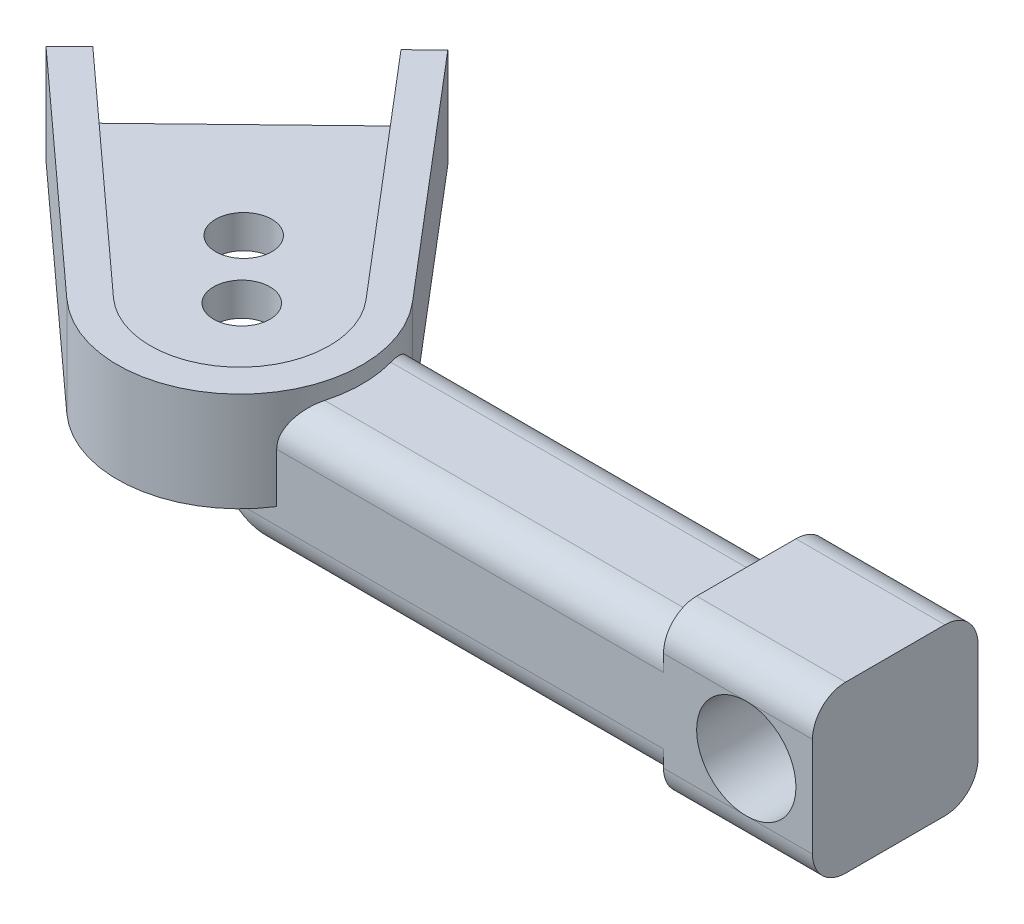
from build123d import *

# Parameters (mm, degrees)
SKETCH_1_W                = 20.5
SKETCH_1_H                = 4
EXTRUDE_1_DEPTH           = 2
SKETCH_2_R                = 0.85
CUT_EXTRUDE_1_DEPTH       = 13
SKETCH_3_R                = 0.8
CUT_EXTRUDE_2_DEPTH       = 3
FILLET_1_R                = 1
SKETCH_4_W                = 4
SKETCH_4_H                = 4
CUT_EXTRUDE_5_DEPTH       = 1.5
CUT_EXTRUDE_6_DEPTH       = 1.5
SKETCH_7_W                = 1
SKETCH_7_H                = 4
EXTRUDE_2_DEPTH           = 1
FILLET_2_R                = 1
EXTRUDE_3_DEPTH           = 3
CUT_EXTRUDE_7_DEPTH       = 3
EXTRUDE_4_DEPTH           = 1
SKETCH_10_R               = 0.85
CUT_EXTRUDE_8_DEPTH       = 1
EXTRUDE_5_REACH           = 23.907
CUT_EXTRUDE_9_DEPTH       = 20.215826188
EXTRUDE_6_DEPTH           = 5
CUT_EXTRUDE_10_DEPTH      = 22.907341564
CUT_EXTRUDE_10_DEPTH_BACK = 22.907341564
SKETCH_14_R               = 1.5
FILLET_3_R                = 1


with BuildPart() as part:
    # 草图1 → 凸台-拉伸1 (new, symmetric)
    with BuildSketch(Plane.XY):
        Rectangle(SKETCH_1_W, SKETCH_1_H)
    extrude(amount=EXTRUDE_1_DEPTH, both=True)

    # 草图2 → 切除-拉伸1 (cut)
    with BuildSketch(Plane.XZ.offset(2)):
        with Locations(Location((-9.048459148, 0, 0), (0, 0, 270))):
            Circle(SKETCH_2_R)
    extrude(amount=-CUT_EXTRUDE_1_DEPTH, mode=Mode.SUBTRACT)

    # 草图3 → 切除-拉伸2 (cut)
    with BuildSketch(Plane.XY.offset(2)):
        with Locations((8.25, 0)):
            Circle(SKETCH_3_R)
    extrude(amount=-CUT_EXTRUDE_2_DEPTH, mode=Mode.SUBTRACT)

    # 圆角1
    fillet_1_edges = [part.edges().sort_by_distance(p)[0] for p in [
        (0, -2, 2),
        (0, -2, -2),
        (0, 2, -2),
        (0, 2, 2),
    ]]
    fillet(fillet_1_edges, radius=FILLET_1_R)

    # 草图4 → 切除-拉伸5 (cut)
    with BuildSketch(Plane.XZ.offset(2)):
        with Locations((-8.25, 0)):
            Rectangle(SKETCH_4_W, SKETCH_4_H)
    extrude(amount=-CUT_EXTRUDE_5_DEPTH, mode=Mode.SUBTRACT)

    # 草图5 → 切除-拉伸6 (cut)
    with BuildSketch(Plane(origin=(0, 2, 0), x_dir=(1, 0, 0), z_dir=(0, 1, 0))):
        Polygon((-6.25, 0), (-6.25, 2), (-10.25, 2), (-10.25, -2), (-6.25, -2), align=None)
    extrude(amount=-CUT_EXTRUDE_6_DEPTH, mode=Mode.SUBTRACT)

    # 草图7 → 凸台-拉伸2 (add)
    with BuildSketch(Plane.XZ.offset(0.5)):
        with Locations((-10.75, 0)):
            Rectangle(SKETCH_7_W, SKETCH_7_H)
    extrude(amount=-EXTRUDE_2_DEPTH)

    # 圆角2
    fillet_2_edges = [part.edges().sort_by_distance(p)[0] for p in [
        (-11.25, 0, 2),
        (-11.25, 0, -2),
    ]]
    fillet(fillet_2_edges, radius=FILLET_2_R)

    # 草图8 → 凸台-拉伸3 (add)
    with BuildSketch(Plane.XZ.offset(0.5)):
        with BuildLine():
            Line((-13.011033862, -8.830832343), (-6.991216755, -1.748643399))
            ThreePointArc((-6.991216755, -1.748643399), (-7.171159983, 1.940553489), (-10.864293035, 1.998186001))
            Line((-10.864293035, 1.998186001), (-17.742872996, -4.252662808))
            Line((-17.742872996, -4.252662808), (-18.461553282, -3.557322138))
            Line((-18.461553282, -3.557322138), (-11.537428317, 2.737705696))
            ThreePointArc((-11.537428317, 2.737705696), (-6.475862877, 2.659275921), (-6.229806023, -2.396913549))
            Line((-6.229806023, -2.396913549), (-12.292353576, -9.526173013))
            Line((-12.292353576, -9.526173013), (-13.011033862, -8.830832343))
        make_face()
    extrude(amount=-EXTRUDE_3_DEPTH)

    # 草图9 → 切除-拉伸7 (cut)
    with BuildSketch(Plane.XZ.offset(0.5)):
        with BuildLine():
            Line((-13.011033862, -8.830832343), (-6.989420262, -1.751365983))
            ThreePointArc((-6.989420262, -1.751365983), (-7.168982159, 1.942804723), (-10.867073667, 1.999891291))
            Line((-10.867073667, 1.999891291), (-17.742872996, -4.252662808))
            Line((-17.742872996, -4.252662808), (-13.011033862, -8.830832343))
        make_face()
    extrude(amount=-CUT_EXTRUDE_7_DEPTH, mode=Mode.SUBTRACT)

    # 草图9<2> → 凸台-拉伸4 (add)
    with BuildSketch(Plane.XZ.offset(0.5)):
        with BuildLine():
            Line((-13.011033862, -8.830832343), (-6.989420262, -1.751365983))
            ThreePointArc((-6.989420262, -1.751365983), (-7.168982159, 1.942804723), (-10.867073667, 1.999891291))
            Line((-10.867073667, 1.999891291), (-17.742872996, -4.252662808))
            Line((-17.742872996, -4.252662808), (-13.011033862, -8.830832343))
        make_face()
    extrude(amount=-EXTRUDE_4_DEPTH)

    # 草图10 → 切除-拉伸8 (cut)
    with BuildSketch(Plane(origin=(0, 0.5, 0), x_dir=(1, 0, 0), z_dir=(0, 1, 0))):
        with Locations(Location((-10.786836392, 1.796675975, 0), (0, 0, 270))):
            Circle(SKETCH_10_R)
        with Locations(Location((-12.525213635, 3.59335195, 0), (0, 0, 270))):
            Circle(SKETCH_10_R)
    extrude(amount=-CUT_EXTRUDE_8_DEPTH, mode=Mode.SUBTRACT)

    # 凸台-拉伸5: up to this face of the body (flat: up to its plane)
    extrude_5_end = Plane(part.part.faces().sort_by_distance((2.117336662, -0.003624728, -2))[0])
    # 草图11 → 凸台-拉伸5 (add, up to the picked face)
    with BuildSketch(Plane.XY.offset(2), mode=Mode.PRIVATE) as extrude_5_sk1:
        Polygon((-6.25, -2), (-6.25, -0.5), (-7.75, -0.5), align=None)
    extrude_5_tool1 = split(extrude(extrude_5_sk1.sketch, amount=-EXTRUDE_5_REACH, mode=Mode.PRIVATE), bisect_by=extrude_5_end, keep=Keep.BOTH, mode=Mode.PRIVATE)
    add(extrude_5_tool1.solids().sort_by(Axis((-6.75, -1, 2), (0, 0, -1)))[0])

    # 草图12 → 切除-拉伸9 (cut, through all)
    with BuildSketch(Plane(origin=(-6.25, 0, 0), x_dir=(0, 0, -1), z_dir=(1, 0, 0))):
        with BuildLine():
            Line((2, -1), (2, -2))
            Line((2, -2), (1, -2))
            ThreePointArc((1, -2), (1.707106781, -1.707106781), (2, -1))
        make_face()
        with BuildLine():
            Line((-1, -2), (-2, -2))
            Line((-2, -2), (-2, -1))
            ThreePointArc((-2, -1), (-1.707106781, -1.707106781), (-1, -2))
        make_face()
    extrude(amount=-CUT_EXTRUDE_9_DEPTH, mode=Mode.SUBTRACT)

    # 草图13 → 凸台-拉伸6 (add)
    with BuildSketch(Plane.XY.offset(2)):
        Polygon((10.25, -2), (10.25, 2.5), (5.75, 2.5), (5.75, -2.5), (10.25, -2.5), align=None)
    extrude(amount=-EXTRUDE_6_DEPTH)

    # 草图14 → 切除-拉伸10 (cut, two sides: drawn at the far end of the back side and taken through both)
    with BuildSketch(Plane.XY.offset(2).offset(-CUT_EXTRUDE_10_DEPTH_BACK)):
        with Locations((8.25, 0)):
            Circle(SKETCH_14_R)
    extrude(amount=CUT_EXTRUDE_10_DEPTH + CUT_EXTRUDE_10_DEPTH_BACK, mode=Mode.SUBTRACT)

    # 圆角3
    fillet_3_edges = [part.edges().sort_by_distance(p)[0] for p in [
        (8, 2.5, 2),
        (8, -2.5, 2),
        (8, 2.5, -3),
        (8, -2.5, -3),
    ]]
    fillet(fillet_3_edges, radius=FILLET_3_R)


solid = part.part
